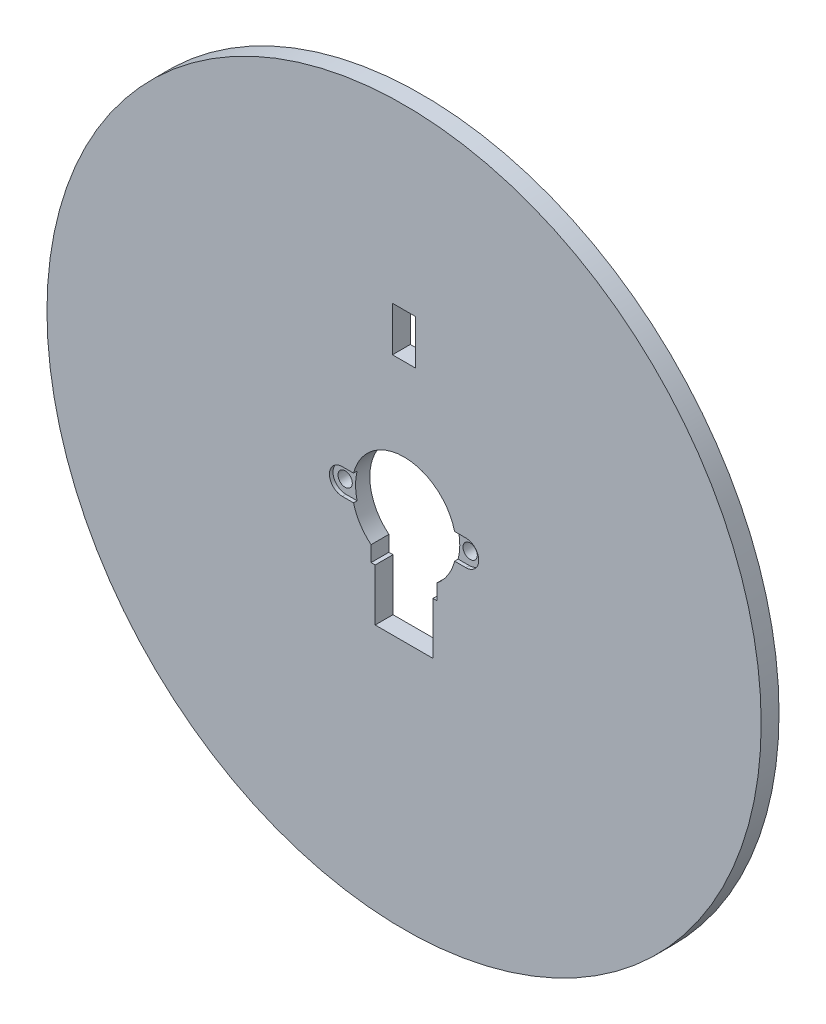
from build123d import *

# Parameters (mm, degrees)
SKETCH1_R           = 100
SKETCH1_R_2         = 2
SKETCH1_W           = 6.5
SKETCH1_H           = 12.5
BOSS_EXTRUDE1_DEPTH = 5
SKETCH1_3_R         = 2
BOSS_EXTRUDE2_DEPTH = 4
SKETCH1_4_R         = 2
BOSS_EXTRUDE3_DEPTH = 1
SKETCH1_6_R         = 2
BOSS_EXTRUDE6_DEPTH = 5
SKETCH1_7_R         = 2
CUT_EXTRUDE1_DEPTH  = 3


with BuildPart() as part:
    # Sketch1 → Boss-Extrude1 (new body)
    with BuildSketch(Plane.XY):
        Circle(SKETCH1_R)
        with BuildLine():
            Line((-17.3, 3.6), (-14.149204925, 3.6))
            ThreePointArc((-14.149204925, 3.6), (0, 14.6), (14.149204925, 3.6))
            Line((14.149204925, 3.6), (17.3, 3.6))
            ThreePointArc((17.3, 3.6), (20.9, 0), (17.3, -3.6))
            Line((17.3, -3.6), (14.149204925, -3.6))
            ThreePointArc((14.149204925, -3.6), (12.316145556, -7.840443778), (9.25, -11.295906338))
            Line((9.25, -11.295906338), (9.25, -15.647016094))
            Line((9.25, -15.647016094), (8.1, -15.647016094))
            Line((8.1, -15.647016094), (8.1, -30.2))
            Line((8.1, -30.2), (-8.1, -30.2))
            Line((-8.1, -30.2), (-8.1, -15.647016094))
            Line((-8.1, -15.647016094), (-9.25, -15.647016094))
            Line((-9.25, -15.647016094), (-9.25, -11.295906338))
            ThreePointArc((-9.25, -11.295906338), (-12.316145556, -7.840443778), (-14.149204925, -3.6))
            Line((-14.149204925, -3.6), (-17.3, -3.6))
            ThreePointArc((-17.3, -3.6), (-20.9, 0), (-17.3, 3.6))
        make_face(mode=Mode.SUBTRACT)
        with Locations((0, 32)):
            Circle(SKETCH1_R_2, mode=Mode.SUBTRACT)
        with Locations((0, 44)):
            Rectangle(SKETCH1_W, SKETCH1_H, mode=Mode.SUBTRACT)
        with Locations((0, 56)):
            Circle(SKETCH1_R_2, mode=Mode.SUBTRACT)
    extrude(amount=BOSS_EXTRUDE1_DEPTH)

    # Sketch1<3> → Boss-Extrude2 (add)
    # profile 1 of 2: a face of its own
    with BuildSketch(Plane.XY):
        with BuildLine():
            ThreePointArc((-14.149204925, -3.6), (-14.6, 0), (-14.149204925, 3.6))
            Line((-14.149204925, 3.6), (-17.3, 3.6))
            ThreePointArc((-17.3, 3.6), (-20.9, 0), (-17.3, -3.6))
            Line((-17.3, -3.6), (-14.149204925, -3.6))
        make_face()
        with Locations((-17.5, 0)):
            Circle(SKETCH1_3_R, mode=Mode.SUBTRACT)
    # profile 2 of 2: a face of its own
    with BuildSketch(Plane.XY):
        with BuildLine():
            Line((17.3, 3.6), (14.149204925, 3.6))
            ThreePointArc((14.149204925, 3.6), (14.6, 0), (14.149204925, -3.6))
            Line((14.149204925, -3.6), (17.3, -3.6))
            ThreePointArc((17.3, -3.6), (20.9, 0), (17.3, 3.6))
        make_face()
        with Locations((17.5, 0)):
            Circle(SKETCH1_3_R, mode=Mode.SUBTRACT)
    extrude(amount=BOSS_EXTRUDE2_DEPTH)

    # Sketch1<4> → Boss-Extrude3 (add)
    with BuildSketch(Plane.XY):
        with Locations((17.5, 0)):
            Circle(SKETCH1_4_R)
        with Locations((-17.5, 0)):
            Circle(SKETCH1_4_R)
    extrude(amount=BOSS_EXTRUDE3_DEPTH)

    # Sketch1<6> → Boss-Extrude6 (add)
    with BuildSketch(Plane.XY):
        with Locations((0, 56)):
            Circle(SKETCH1_6_R)
        with Locations((0, 32)):
            Circle(SKETCH1_6_R)
    extrude(amount=BOSS_EXTRUDE6_DEPTH)

    # Sketch1<7> → Cut-Extrude1 (cut)
    with BuildSketch(Plane.XY):
        with Locations((0, 56)):
            Circle(SKETCH1_7_R)
        with Locations((0, 32)):
            Circle(SKETCH1_7_R)
    extrude(amount=CUT_EXTRUDE1_DEPTH, mode=Mode.SUBTRACT)


solid = part.part
